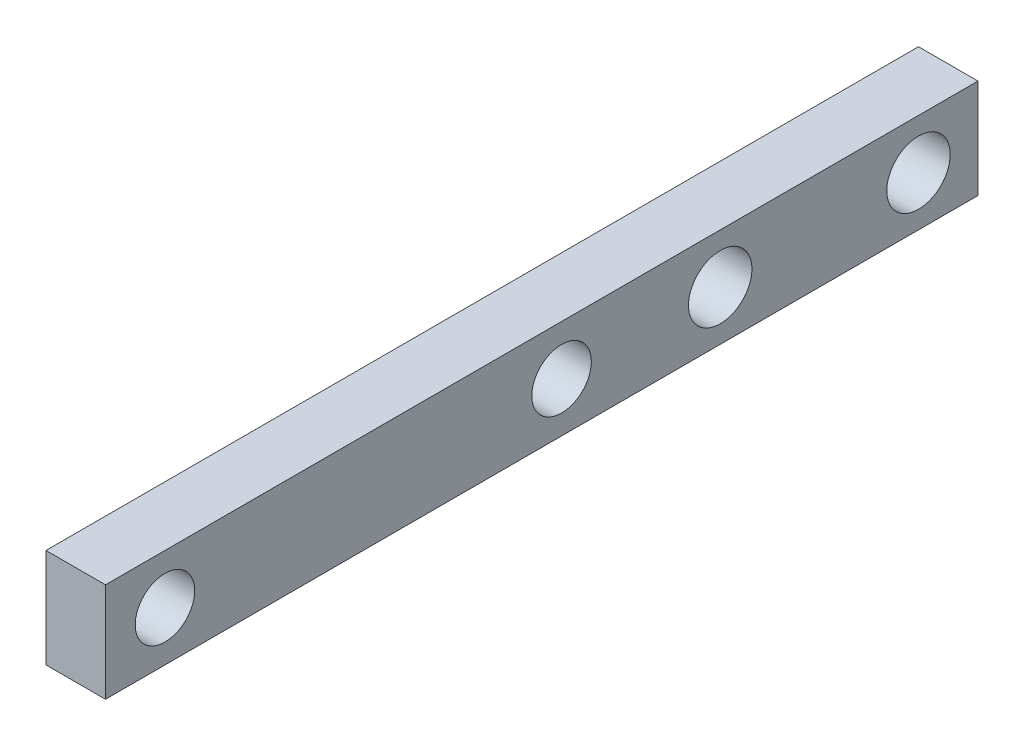
from build123d import *

# Parameters (mm, degrees)
SKETCH2_W           = 44
SKETCH2_H           = 5
SKETCH2_R           = 1.6
SKETCH2_R_2         = 1.5
BOSS_EXTRUDE1_DEPTH = 3


with BuildPart() as part:
    # Sketch2 → Boss-Extrude1 (new body)
    with BuildSketch(Plane(origin=(0, 0, 0), x_dir=(0, 0, -1), z_dir=(1, 0, 0))):
        Rectangle(SKETCH2_W, SKETCH2_H)
        with Locations((19, 0)):
            Circle(SKETCH2_R, mode=Mode.SUBTRACT)
        with Locations((9, 0)):
            Circle(SKETCH2_R, mode=Mode.SUBTRACT)
        with Locations((1, 0)):
            Circle(SKETCH2_R_2, mode=Mode.SUBTRACT)
        with Locations((-19, 0)):
            Circle(SKETCH2_R_2, mode=Mode.SUBTRACT)
    extrude(amount=BOSS_EXTRUDE1_DEPTH)


solid = part.part
